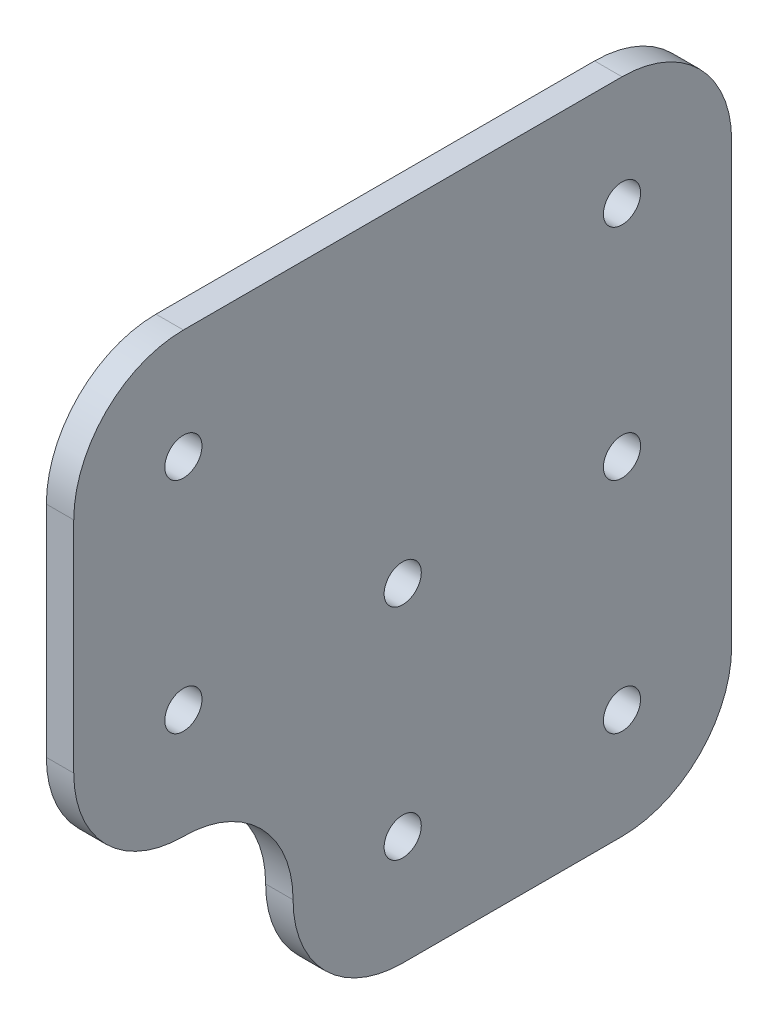
from build123d import *

# Parameters (mm, degrees)
SKETCH1_W             = 76.2
SKETCH1_H             = 76.2
BOSS_EXTRUDE1_DEPTH   = 1.5875
F_8_CLEARANCE_HOLE1_D = 4.3053
SKETCH4_W             = 101.6
SKETCH4_H             = 101.6
CUT_EXTRUDE1_DEPTH    = 54.975


with BuildPart() as part:
    # Sketch1 → Boss-Extrude1 (new, symmetric)
    with BuildSketch(Plane(origin=(0, 0, 0), x_dir=(0, 0, -1), z_dir=(1, 0, 0))):
        Rectangle(SKETCH1_W, SKETCH1_H)
    extrude(amount=BOSS_EXTRUDE1_DEPTH, both=True)

    # #8 Clearance Hole1 (through all)
    with Locations(Plane(origin=(1.5875, 0, 0), x_dir=(0, 0, -1), z_dir=(1, 0, 0))):
        with Locations((-25.4, 25.4), (-25.4, 0), (25.4, 25.4), (0, 0), (25.4, 0), (0, -25.4), (25.4, -25.4)):
            Hole(F_8_CLEARANCE_HOLE1_D / 2)

    # Sketch4 → Cut-Extrude1 (cut, through all)
    with BuildSketch(Plane(origin=(1.5875, 0, 0), x_dir=(0, 0, -1), z_dir=(1, 0, 0))):
        Rectangle(SKETCH4_W, SKETCH4_H)
        with BuildLine():
            Line((-38.1, 0), (-38.1, 25.4))
            ThreePointArc((-38.1, 25.4), (-34.380256121, 34.380256121), (-25.4, 38.1))
            Line((-25.4, 38.1), (25.4, 38.1))
            ThreePointArc((25.4, 38.1), (34.380256121, 34.380256121), (38.1, 25.4))
            Line((38.1, 25.4), (38.1, -25.4))
            ThreePointArc((38.1, -25.4), (34.380256121, -34.380256121), (25.4, -38.1))
            Line((25.4, -38.1), (0, -38.1))
            ThreePointArc((0, -38.1), (-8.980256121, -34.380256121), (-12.7, -25.4))
            ThreePointArc((-12.7, -25.4), (-16.419743879, -16.419743879), (-25.4, -12.7))
            ThreePointArc((-25.4, -12.7), (-34.380256121, -8.980256121), (-38.1, 0))
        make_face(mode=Mode.SUBTRACT)
    extrude(amount=-CUT_EXTRUDE1_DEPTH, mode=Mode.SUBTRACT)


solid = part.part
